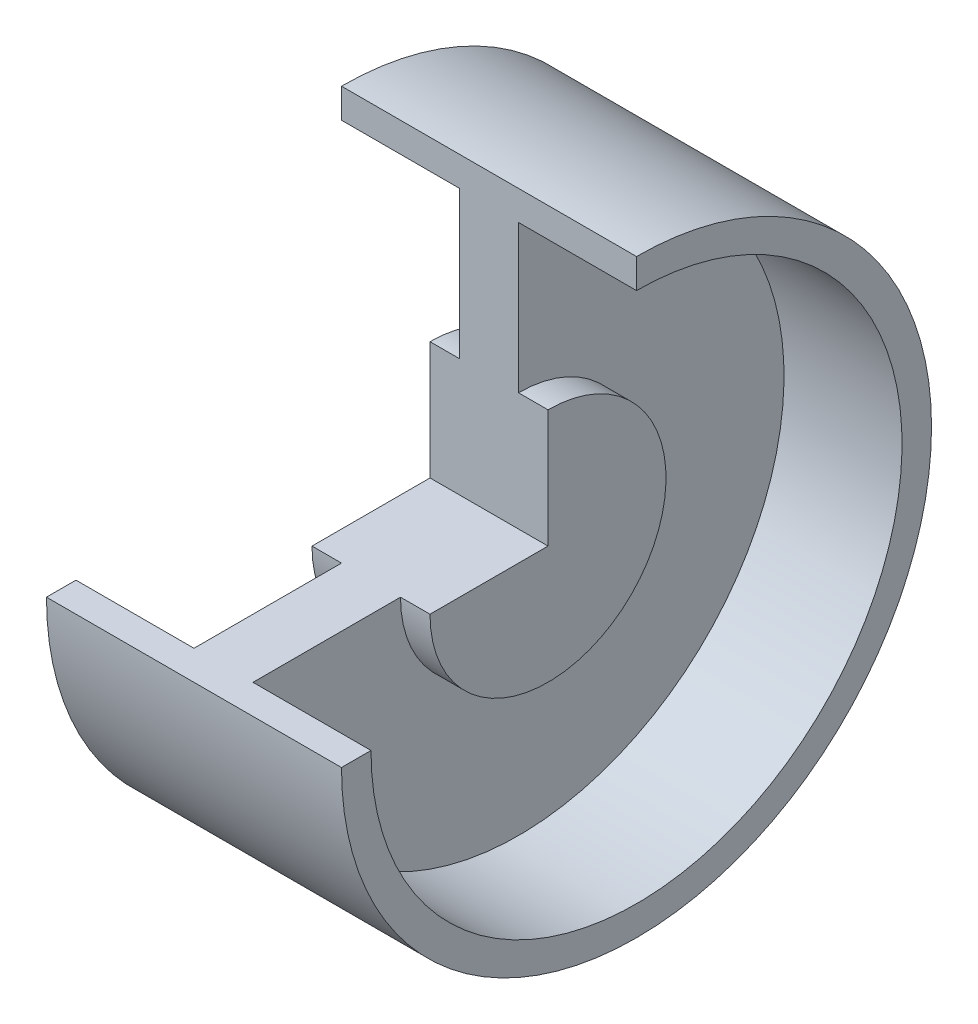
from build123d import *

# Parameters (mm, degrees)
REVOLVE1_ANGLE = 270


with BuildPart() as part:
    # Sketch1 → Revolve1 (revolve)
    with BuildSketch(Plane.XY):
        Polygon((-10, 20), (-10, 0), (10, 0), (10, 20), (5, 20), (5, 45), (25, 45), (25, 50), (-25, 50), (-25, 45), (-5, 45), (-5, 20), align=None)
    revolve(axis=Axis((-10, 0, 0), (-1, 0, 0)), revolution_arc=REVOLVE1_ANGLE)


solid = part.part
